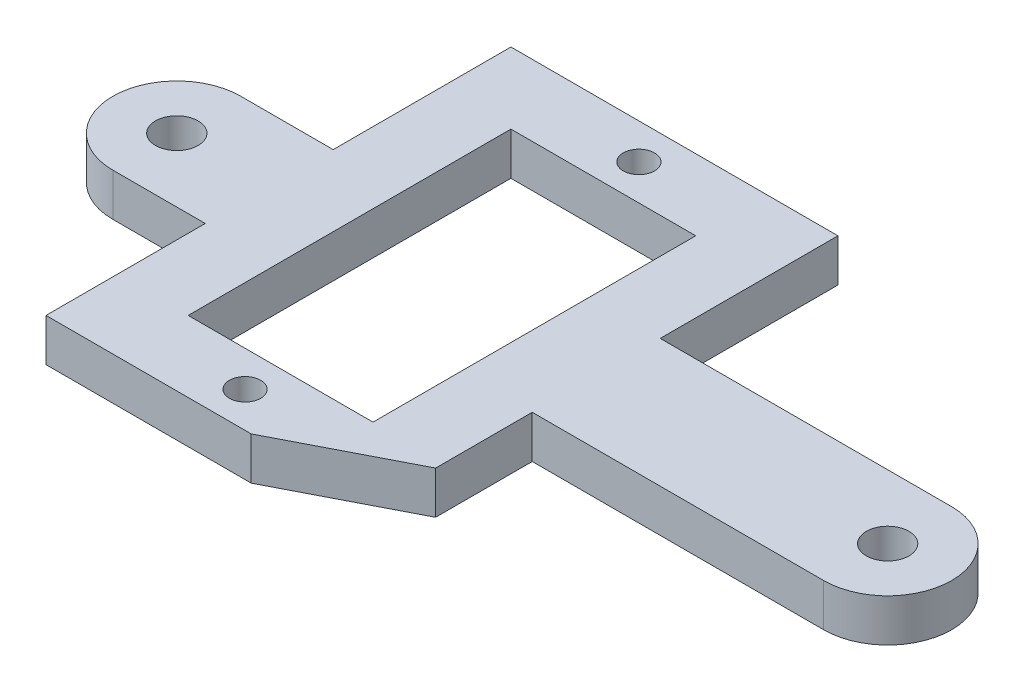
from build123d import *

# Parameters (mm, degrees)
SKETCH_1_R          = 4.5
SKETCH_1_R_2        = 1.5
SKETCH_1_W          = 5
SKETCH_1_H          = 9
SKETCH_1_R_3        = 2.5
SKETCH_1_R_4        = 1.1
EXTRUDE_1_DEPTH     = 3
CUT_EXTRUDE_1_DEPTH = 35.179672321


with BuildPart() as part:
    # 草图1 → 凸台-拉伸1 (new body)
    # profile 1 of 12: a face of its own
    with BuildSketch(Plane(origin=(0, 0, 0), x_dir=(1, 0, 0), z_dir=(0, 1, 0))):
        with Locations((-25, 0)):
            Circle(SKETCH_1_R)
        with Locations(Location((-25, 0, 0), (0, 0, 270))):
            Circle(SKETCH_1_R_2, mode=Mode.SUBTRACT)
    # profile 2 of 12: a face of its own
    with BuildSketch(Plane(origin=(0, 0, 0), x_dir=(1, 0, 0), z_dir=(0, 1, 0))):
        with BuildLine():
            Line((-18.5, 4.5), (-25, 4.5))
            ThreePointArc((-25, 4.5), (-21.818019485, 3.181980515), (-20.5, 0))
            ThreePointArc((-20.5, 0), (-21.818019485, -3.181980515), (-25, -4.5))
            Line((-25, -4.5), (-18.5, -4.5))
            Line((-18.5, -4.5), (-18.5, 4.5))
        make_face()
    # profile 3 of 12: a face of its own
    with BuildSketch(Plane(origin=(0, 0, 0), x_dir=(1, 0, 0), z_dir=(0, 1, 0))):
        with Locations((-16, 0)):
            Rectangle(SKETCH_1_W, SKETCH_1_H)
    # profile 4 of 12: a face of its own
    with BuildSketch(Plane(origin=(0, 0, 0), x_dir=(1, 0, 0), z_dir=(0, 1, 0))):
        with BuildLine():
            Line((-13.5, -4.5), (-18.5, -4.5))
            Line((-18.5, -4.5), (-18.5, -15.7))
            Line((-18.5, -15.7), (-7.000000018, -15.7))
            ThreePointArc((-7.000000018, -15.7), (-9.5, -13.199999991), (-7, -10.7))
            Line((-7, -10.7), (-13.5, -10.7))
            Line((-13.5, -10.7), (-13.5, -4.5))
        make_face()
    # profile 5 of 12: a face of its own
    with BuildSketch(Plane(origin=(0, 0, 0), x_dir=(1, 0, 0), z_dir=(0, 1, 0))):
        with BuildLine():
            Line((4.5, -4.5), (-0.5, -4.5))
            Line((-0.5, -4.5), (-0.5, -10.7))
            Line((-0.5, -10.7), (-7, -10.7))
            ThreePointArc((-7, -10.7), (-5.232233047, -11.432233047), (-4.5, -13.2))
            ThreePointArc((-4.5, -13.2), (-5.232233054, -14.967766959), (-7.000000018, -15.7))
            Line((-7.000000018, -15.7), (4.5, -15.7))
            Line((4.5, -15.7), (4.5, -4.5))
        make_face()
    # profile 6 of 12: a face of its own
    with BuildSketch(Plane(origin=(0, 0, 0), x_dir=(1, 0, 0), z_dir=(0, 1, 0))):
        Polygon((4.5, 4.5), (-0.5, 4.5), (-0.5, -4.5), (4.5, -4.5), (4.5, 0), align=None)
    # profile 7 of 12: a face of its own
    with BuildSketch(Plane(origin=(0, 0, 0), x_dir=(1, 0, 0), z_dir=(0, 1, 0))):
        with BuildLine():
            Line((-0.5, 12), (-0.5, 4.5))
            Line((-0.5, 4.5), (4.5, 4.5))
            Line((4.5, 4.5), (4.5, 17))
            Line((4.5, 17), (-7.000000057, 17))
            ThreePointArc((-7.000000057, 17), (-5.232233067, 16.267766973), (-4.5, 14.5))
            ThreePointArc((-4.5, 14.5), (-5.232233047, 12.732233047), (-7, 12))
            Line((-7, 12), (-0.5, 12))
        make_face()
    # profile 8 of 12: a face of its own
    with BuildSketch(Plane(origin=(0, 0, 0), x_dir=(1, 0, 0), z_dir=(0, 1, 0))):
        with BuildLine():
            Line((-18.5, 17), (-18.5, 4.5))
            Line((-18.5, 4.5), (-13.5, 4.5))
            Line((-13.5, 4.5), (-13.5, 12))
            Line((-13.5, 12), (-7, 12))
            ThreePointArc((-7, 12), (-9.5, 14.499999972), (-7.000000057, 17))
            Line((-7.000000057, 17), (-18.5, 17))
        make_face()
    # profile 9 of 12: a face of its own
    with BuildSketch(Plane(origin=(0, 0, 0), x_dir=(1, 0, 0), z_dir=(0, 1, 0))):
        with BuildLine():
            Line((25, 4.5), (4.5, 4.5))
            Line((4.5, 4.5), (4.5, 0))
            Line((4.5, 0), (4.5, -4.5))
            Line((4.5, -4.5), (25, -4.5))
            ThreePointArc((25, -4.5), (20.5, 0), (25, 4.5))
        make_face()
    # profile 10 of 12: a face of its own
    with BuildSketch(Plane(origin=(0, 0, 0), x_dir=(1, 0, 0), z_dir=(0, 1, 0))):
        with Locations((25, 0)):
            Circle(SKETCH_1_R)
        with Locations(Location((25, 0, 0), (0, 0, 270))):
            Circle(SKETCH_1_R_2, mode=Mode.SUBTRACT)
    # profile 11 of 12: a face of its own
    with BuildSketch(Plane(origin=(0, 0, 0), x_dir=(1, 0, 0), z_dir=(0, 1, 0))):
        with Locations((-7, 14.5)):
            Circle(SKETCH_1_R_3)
        with Locations(Location((-7, 14.5, 0), (0, 0, 270))):
            Circle(SKETCH_1_R_4, mode=Mode.SUBTRACT)
    # profile 12 of 12: a face of its own
    with BuildSketch(Plane(origin=(0, 0, 0), x_dir=(1, 0, 0), z_dir=(0, 1, 0))):
        with Locations((-7, -13.2)):
            Circle(SKETCH_1_R_3)
        with Locations(Location((-7, -13.2, 0), (0, 0, 270))):
            Circle(SKETCH_1_R_4, mode=Mode.SUBTRACT)
    extrude(amount=EXTRUDE_1_DEPTH)

    # 草图2 → 切除-拉伸1 (cut, through all)
    with BuildSketch(Plane(origin=(0, 3, 0), x_dir=(1, 0, 0), z_dir=(0, 1, 0))):
        Polygon((4.5, -15.7), (4.5, -11.296015474), (-4.064964363, -15.7), align=None)
    extrude(amount=-CUT_EXTRUDE_1_DEPTH, mode=Mode.SUBTRACT)


solid = part.part
